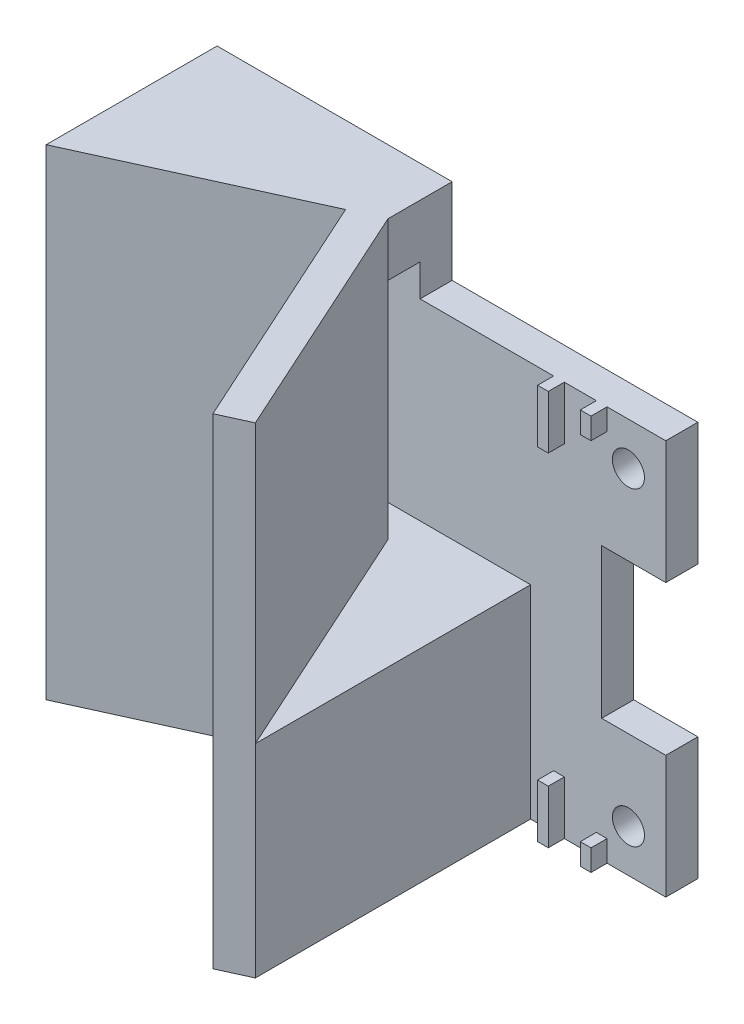
from build123d import *

# Parameters (mm, degrees)
CROQUIS1_R              = 1.5
SALIENTE_EXTRUIR1_DEPTH = 3
CROQUIS3_W              = 22
CROQUIS3_H              = 37
SALIENTE_EXTRUIR2_DEPTH = 13
CORTAR_EXTRUIR1_START   = -37
CORTAR_EXTRUIR1_DEPTH   = 37
SALIENTE_EXTRUIR4_DEPTH = 8
CROQUIS7_W              = 3.002058729
CROQUIS7_H              = 21
CORTAR_EXTRUIR2_DEPTH   = 22
CROQUIS8_W              = 3
CROQUIS8_H              = 45
SALIENTE_EXTRUIR5_DEPTH = 25
SALIENTE_EXTRUIR6_START = -19
SALIENTE_EXTRUIR6_DEPTH = 19
CROQUIS13_W             = 1
CROQUIS13_H             = 2
CROQUIS13_H_2           = 5
SALIENTE_EXTRUIR8_DEPTH = 1.5


with BuildPart() as part:
    # Croquis1 → Saliente-Extruir1 (new body)
    with BuildSketch(Plane.XY):
        with BuildLine():
            Line((-4.197309417, 33.461883408), (-52.197309417, 33.461883408))
            ThreePointArc((-52.197309417, 33.461883408), (-55.025736542, 32.290310533), (-56.197309417, 29.461883408))
            Line((-56.197309417, 29.461883408), (-56.197309417, 24.961883408))
            Line((-56.197309417, 24.961883408), (-49.197309417, 24.961883408))
            Line((-49.197309417, 24.961883408), (-49.197309417, 4.961883408))
            Line((-49.197309417, 4.961883408), (-56.197309417, 4.961883408))
            Line((-56.197309417, 4.961883408), (-56.197309417, 0.461883408))
            ThreePointArc((-56.197309417, 0.461883408), (-55.099110766, -2.293519818), (-52.406664651, -3.538116592))
            Line((-52.406664651, -3.538116592), (-4.197309417, -3.538116592))
            Line((-4.197309417, -3.538116592), (-4.197309417, 7.961883408))
            Line((-4.197309417, 7.961883408), (-10.197309417, 7.961883408))
            Line((-10.197309417, 7.961883408), (-10.197309417, 21.961883408))
            Line((-10.197309417, 21.961883408), (-4.197309417, 21.961883408))
            Line((-4.197309417, 21.961883408), (-4.197309417, 33.461883408))
        make_face()
        with Locations((-52.19152813, 0.461883408)):
            Circle(CROQUIS1_R, mode=Mode.SUBTRACT)
        with Locations((-7.69152813, 0.461883408)):
            Circle(CROQUIS1_R, mode=Mode.SUBTRACT)
        with Locations((-52.197309417, 29.461883408)):
            Circle(CROQUIS1_R, mode=Mode.SUBTRACT)
        with Locations((-7.697309417, 29.461882832)):
            Circle(CROQUIS1_R, mode=Mode.SUBTRACT)
    extrude(amount=SALIENTE_EXTRUIR1_DEPTH)

    # Croquis3 → Saliente-Extruir2 (add)
    with BuildSketch(Plane.XY.offset(3)):
        with Locations((-38.197309417, 14.961883408)):
            Rectangle(CROQUIS3_W, CROQUIS3_H)
    extrude(amount=SALIENTE_EXTRUIR2_DEPTH)

    # Croquis4 → Cortar-Extruir1 (cut)
    with BuildSketch(Plane.XZ.offset(3.538116592).offset(CORTAR_EXTRUIR1_START)):
        Polygon((-27.197309417, 16), (-27.197309417, 6.002058729), (-49.197309417, 16), align=None)
    extrude(amount=CORTAR_EXTRUIR1_DEPTH, mode=Mode.SUBTRACT)

    # Croquis6 → Saliente-Extruir4 (add)
    with BuildSketch(Plane(origin=(0, 33.461883408, 0), x_dir=(1, 0, 0), z_dir=(0, 1, 0))):
        Polygon((-27.197309417, -6.002058729), (-49.197309417, -16), (-49.197309417, 0), (-27.197309417, 0), align=None)
    extrude(amount=SALIENTE_EXTRUIR4_DEPTH)

    # Croquis7 → Cortar-Extruir2 (cut)
    with BuildSketch(Plane(origin=(-27.197309417, 0, 0), x_dir=(0, 0, -1), z_dir=(1, 0, 0))):
        with Locations((-4.501029365, 25.961883408)):
            Rectangle(CROQUIS7_W, CROQUIS7_H)
    extrude(amount=-CORTAR_EXTRUIR2_DEPTH, mode=Mode.SUBTRACT)

    # Croquis8 → Saliente-Extruir5 (add)
    with BuildSketch(Plane(origin=(-2.394740987, 0, -5.269515022), x_dir=(0.9103985682863143, 0, -0.4137323372208525), z_dir=(0.4137323372208525, 0, 0.9103985682863143))):
        with Locations((-28.743637341, 18.961883408)):
            Rectangle(CROQUIS8_W, CROQUIS8_H)
    extrude(amount=SALIENTE_EXTRUIR5_DEPTH)

    # Croquis9 → Saliente-Extruir6 (add)
    with BuildSketch(Plane.XZ.offset(3.538116592).offset(SALIENTE_EXTRUIR6_START)):
        Polygon((-16.854000987, 28.762022936), (-27.197309417, 6.002058729), (-27.197309417, 3), (-16.854000987, 3), align=None)
    extrude(amount=SALIENTE_EXTRUIR6_DEPTH)

    # Croquis13 → Saliente-Extruir8 (add)
    with BuildSketch(Plane.XY.offset(3)):
        with Locations((-10.197309417, -2.538116592)):
            Rectangle(CROQUIS13_W, CROQUIS13_H)
        with Locations((-10.197309417, 32.461883408)):
            Rectangle(CROQUIS13_W, CROQUIS13_H)
        with Locations((-14.197309417, 30.961883408)):
            Rectangle(CROQUIS13_W, CROQUIS13_H_2)
        with Locations((-14.197309417, -1.038116592)):
            Rectangle(CROQUIS13_W, CROQUIS13_H_2)
    extrude(amount=SALIENTE_EXTRUIR8_DEPTH)


solid = part.part
